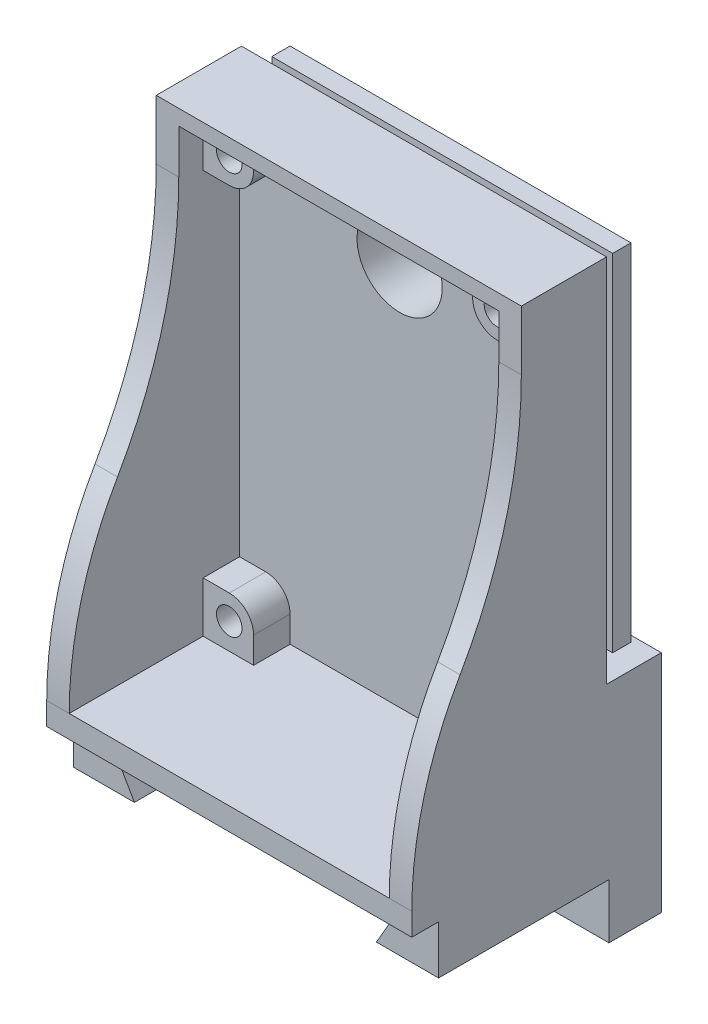
from build123d import *

# Parameters (mm, degrees)
SKETCH2_W             = 30
SKETCH2_H             = 18.5
BOSS_EXTRUDE1_DEPTH   = 4.5
BOSS_EXTRUDE2_DEPTH   = 2
SKETCH4_W             = 26.3
SKETCH4_H             = 37.3
BOSS_EXTRUDE3_DEPTH   = 12
SKETCH5_W             = 30
SKETCH5_H             = 40.415903306
SKETCH5_W_2           = 26.3
SKETCH5_H_2           = 37.3
BOSS_EXTRUDE4_DEPTH   = 2
CUT_EXTRUDE1_DEPTH    = 53.877515324
SKETCH7_R             = 2.75
CUT_EXTRUDE2_DEPTH    = 3
SKETCH8_R             = 1.65
CUT_EXTRUDE3_DEPTH    = 51.656012741
SKETCH9_W             = 0.2
SKETCH9_H             = 4
TOLERANCE_CUT1_DEPTH  = 53.877515324
TOLERANCE_CUT2_DEPTH  = 0.2
BOSS_EXTRUDE5_DEPTH   = 3
SKETCH12_W            = 26.022193388
SKETCH12_H            = 26.438096694
BOSS_EXTRUDE6_DEPTH   = 1.5
SKETCH13_W            = 28.011096694
SKETCH13_H            = 28.427
BOSS_EXTRUDE7_DEPTH   = 1.5
SKETCH14_R            = 3.5
CUT_EXTRUDE6_DEPTH    = 50.555843518
SKETCH15_R            = 1.05
PCB_MOUNT_HOLES_DEPTH = 5
SKETCH16_W            = 1.5
SKETCH16_H            = 1.5
CUT_EXTRUDE8_DEPTH    = 3


with BuildPart() as part:
    # Sketch2 → Boss-Extrude1 (new body)
    with BuildSketch(Plane.XY):
        with Locations((13, -1.25)):
            Rectangle(SKETCH2_W, SKETCH2_H)
    extrude(amount=BOSS_EXTRUDE1_DEPTH)

    # Sketch3 → Boss-Extrude2 (add)
    with BuildSketch(Plane.XY.offset(4.5)):
        Polygon((-2, 38.415903306), (28, 38.415903306), (28, -6), (22.890598923, -6), (25.2, -2), (0.7, -2), (3.009401077, -6), (-2, -6), align=None)
    extrude(amount=BOSS_EXTRUDE2_DEPTH)

    # Sketch4 → Boss-Extrude3 (add)
    with BuildSketch(Plane.XY.offset(6.5)):
        Polygon((-2, 38.415903306), (-2, -6), (3.009401077, -6), (0.7, -2), (25.2, -2), (22.890598923, -6), (28, -6), (28, 38.415903306), align=None)
        with Locations((13, 18.5)):
            Rectangle(SKETCH4_W, SKETCH4_H, mode=Mode.SUBTRACT)
    extrude(amount=BOSS_EXTRUDE3_DEPTH)

    # Sketch5 → Boss-Extrude4 (add)
    with BuildSketch(Plane.XY.offset(18.5)):
        with Locations((13, 18.207951653)):
            Rectangle(SKETCH5_W, SKETCH5_H)
        with Locations((13, 18.5)):
            Rectangle(SKETCH5_W_2, SKETCH5_H_2, mode=Mode.SUBTRACT)
    extrude(amount=BOSS_EXTRUDE4_DEPTH)

    # Sketch6 → Cut-Extrude1 (cut, through all)
    with BuildSketch(Plane(origin=(28, 0, 0), x_dir=(0, 0, -1), z_dir=(1, 0, 0))):
        with BuildLine():
            Line((-11.5, 38.415903306), (-29.920257518, 38.415903306))
            Line((-29.920257518, 38.415903306), (-29.920257518, -0.15))
            Line((-29.920257518, -0.15), (-20.5, -0.15))
            ThreePointArc((-20.5, -0.15), (-19.490822016, 7.533583379), (-16.531743455, 14.695967606))
            ThreePointArc((-16.531743455, 14.695967606), (-12.779636198, 23.777860258), (-11.5, 33.520632668))
            Line((-11.5, 33.520632668), (-11.5, 38.415903306))
        make_face()
    extrude(amount=-CUT_EXTRUDE1_DEPTH, mode=Mode.SUBTRACT)

    # Sketch7 → Cut-Extrude2 (cut)
    with BuildSketch(Plane(origin=(0, 0, 0), x_dir=(-1, 0, 0), z_dir=(0, 0, -1))):
        with Locations((-19.5, -6.25)):
            Circle(SKETCH7_R)
        with Locations(Location((-6.5, -6.25, 0), (0, 0, 180))):
            Circle(SKETCH7_R)
    extrude(amount=-CUT_EXTRUDE2_DEPTH, mode=Mode.SUBTRACT)

    # Sketch8 → Cut-Extrude3 (cut, through all)
    with BuildSketch(Plane(origin=(0, 0, 3), x_dir=(-1, 0, 0), z_dir=(0, 0, -1))):
        with Locations((-19.5, -6.25)):
            Circle(SKETCH8_R)
        with Locations((-6.5, -6.25)):
            Circle(SKETCH8_R)
    extrude(amount=-CUT_EXTRUDE3_DEPTH, mode=Mode.SUBTRACT)

    # Sketch9 → tolerance_cut1 (cut, through all)
    with BuildSketch(Plane.ZY.offset(2)):
        with Locations((18.4, -4)):
            Rectangle(SKETCH9_W, SKETCH9_H)
    extrude(amount=-TOLERANCE_CUT1_DEPTH, mode=Mode.SUBTRACT)

    # Sketch10 → tolerance_cut2 (cut)
    with BuildSketch(Plane.XY.offset(4.5)):
        Polygon((28, -6), (22.890598923, -6), (25.2, -2), (0.7, -2), (3.009401077, -6), (-2, -6), (-2, -10.5), (28, -10.5), align=None)
    extrude(amount=-TOLERANCE_CUT2_DEPTH, mode=Mode.SUBTRACT)

    # Sketch11 → Boss-Extrude5 (add)
    with BuildSketch(Plane.XY.offset(6.5)):
        with BuildLine():
            Line((4, 35), (4, 37.15))
            Line((4, 37.15), (-0.15, 37.15))
            Line((-0.15, 37.15), (-0.15, 33))
            Line((-0.15, 33), (2, 33))
            ThreePointArc((2, 33), (3.414213562, 33.585786438), (4, 35))
        make_face()
        with BuildLine():
            Line((26.15, 33), (24, 33))
            ThreePointArc((24, 33), (22.585786438, 33.585786438), (22, 35))
            Line((22, 35), (22, 37.15))
            Line((22, 37.15), (26.15, 37.15))
            Line((26.15, 37.15), (26.15, 33))
        make_face()
        with BuildLine():
            Line((26.15, 4), (24, 4))
            ThreePointArc((24, 4), (22.585786438, 3.414213562), (22, 2))
            Line((22, 2), (22, -0.15))
            Line((22, -0.15), (26.15, -0.15))
            Line((26.15, -0.15), (26.15, 4))
        make_face()
        with BuildLine():
            Line((-0.15, 4), (2, 4))
            ThreePointArc((2, 4), (3.414213562, 3.414213562), (4, 2))
            Line((4, 2), (4, -0.15))
            Line((4, -0.15), (-0.15, -0.15))
            Line((-0.15, -0.15), (-0.15, 4))
        make_face()
    extrude(amount=BOSS_EXTRUDE5_DEPTH)

    # Sketch12 → Boss-Extrude6 (add)
    with BuildSketch(Plane(origin=(0, 0, 4.5), x_dir=(-1, 0, 0), z_dir=(0, 0, -1))):
        with Locations((-13, 23.207951653)):
            Rectangle(SKETCH12_W, SKETCH12_H)
    extrude(amount=BOSS_EXTRUDE6_DEPTH)

    # Sketch13 → Boss-Extrude7 (add)
    with BuildSketch(Plane(origin=(0, 0, 3), x_dir=(-1, 0, 0), z_dir=(0, 0, -1))):
        with Locations((-13, 23.207951653)):
            Rectangle(SKETCH13_W, SKETCH13_H)
    extrude(amount=BOSS_EXTRUDE7_DEPTH)

    # Sketch14 → Cut-Extrude6 (cut, through all)
    with BuildSketch(Plane.XY.offset(6.5)):
        with Locations((13, 31.463)):
            Circle(SKETCH14_R)
    extrude(amount=-CUT_EXTRUDE6_DEPTH, mode=Mode.SUBTRACT)

    # Sketch15 → pcb_mount_holes (cut)
    with BuildSketch(Plane.XY.offset(9.5)):
        with Locations((2, 35)):
            Circle(SKETCH15_R)
        with Locations((24, 35)):
            Circle(SKETCH15_R)
        with Locations((24, 2)):
            Circle(SKETCH15_R)
        with Locations((2, 2)):
            Circle(SKETCH15_R)
    extrude(amount=-PCB_MOUNT_HOLES_DEPTH, mode=Mode.SUBTRACT)

    # Sketch16 → Cut-Extrude8 (cut)
    with BuildSketch(Plane(origin=(0, 0, 1.5), x_dir=(-1, 0, 0), z_dir=(0, 0, -1))):
        with Locations((-25.261096694, 25.419380652)):
            Rectangle(SKETCH16_W, SKETCH16_H)
        with Locations((-25.261096694, 31.419380652)):
            Rectangle(SKETCH16_W, SKETCH16_H)
        with Locations((-25.261096694, 19.419380652)):
            Rectangle(SKETCH16_W, SKETCH16_H)
        with Locations((-25.261096694, 13.419380652)):
            Rectangle(SKETCH16_W, SKETCH16_H)
        with Locations((-21.014935628, 10.738903306)):
            Rectangle(SKETCH16_W, SKETCH16_H)
        with Locations((-19.514935628, 35.677)):
            Rectangle(SKETCH16_W, SKETCH16_H)
        with Locations((-4.985064372, 10.738903306)):
            Rectangle(SKETCH16_W, SKETCH16_H)
        with Locations((-0.738903306, 13.419380652)):
            Rectangle(SKETCH16_W, SKETCH16_H)
        with Locations((-0.738903306, 19.419380652)):
            Rectangle(SKETCH16_W, SKETCH16_H)
        with Locations((-0.738903306, 25.419380652)):
            Rectangle(SKETCH16_W, SKETCH16_H)
        with Locations((-0.738903306, 31.419380652)):
            Rectangle(SKETCH16_W, SKETCH16_H)
        with Locations((-6.485064372, 35.677)):
            Rectangle(SKETCH16_W, SKETCH16_H)
    extrude(amount=-CUT_EXTRUDE8_DEPTH, mode=Mode.SUBTRACT)


solid = part.part
